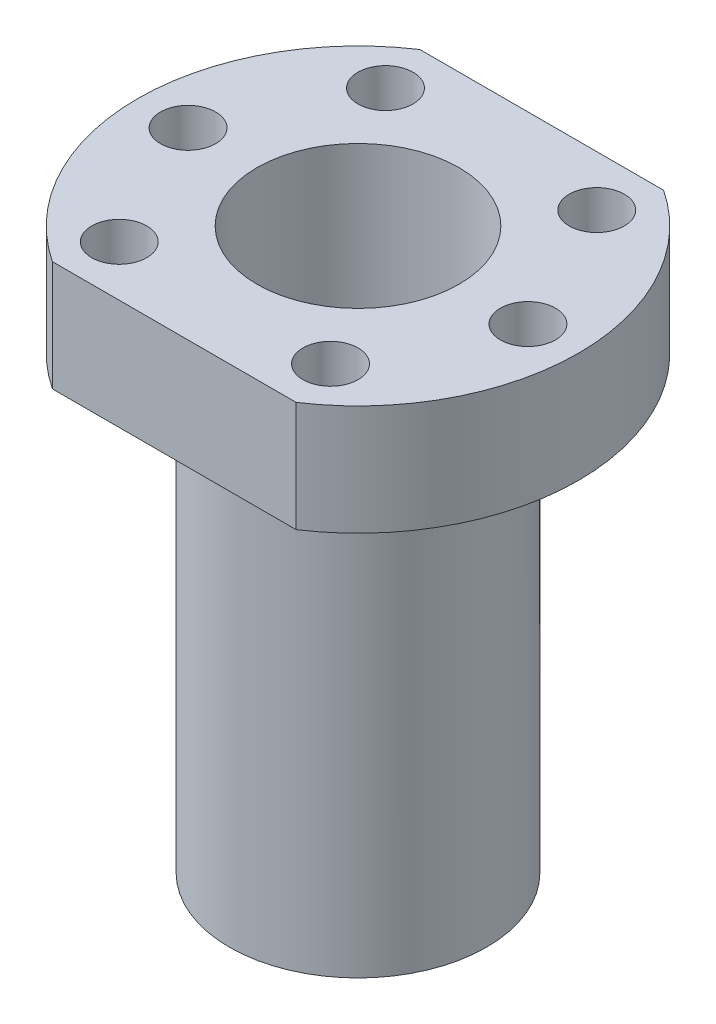
from build123d import *

# Parameters (mm, degrees)
BOSS_EXTRUDE1_DEPTH = 12
SKETCH2_R           = 14
BOSS_EXTRUDE2_DEPTH = 49
SKETCH3_R           = 11
SKETCH3_R_2         = 3
CUT_EXTRUDE1_DEPTH  = 69.534662763


with BuildPart() as part:
    # Sketch1 → Boss-Extrude1 (new body)
    with BuildSketch(Plane(origin=(0, 0, 0), x_dir=(1, 0, 0), z_dir=(0, 1, 0))):
        with BuildLine():
            Line((0, 20), (13.266499161, 20))
            ThreePointArc((13.266499161, 20), (24, 0), (13.266499161, -20))
            Line((13.266499161, -20), (-13.266499161, -20))
            ThreePointArc((-13.266499161, -20), (-24, 0), (-13.266499161, 20))
            Line((-13.266499161, 20), (0, 20))
        make_face()
    extrude(amount=BOSS_EXTRUDE1_DEPTH)

    # Sketch2 → Boss-Extrude2 (add)
    with BuildSketch(Plane.XZ):
        with Locations(Location((0, 0, 0), (0, 0, 90))):
            Circle(SKETCH2_R)
    extrude(amount=BOSS_EXTRUDE2_DEPTH)

    # Sketch3 → Cut-Extrude1 (cut, through all)
    with BuildSketch(Plane(origin=(0, 12, 0), x_dir=(1, 0, 0), z_dir=(0, 1, 0))):
        with Locations(Location((0, 0, 0), (0, 0, 270))):
            Circle(SKETCH3_R)
        with Locations(Location((-11.5, 14.491376746, 0), (0, 0, 270))):
            Circle(SKETCH3_R_2)
        with Locations(Location((-18.5, 0, 0), (0, 0, 270))):
            Circle(SKETCH3_R_2)
        with Locations(Location((-11.5, -14.491376746, 0), (0, 0, 270))):
            Circle(SKETCH3_R_2)
        with Locations(Location((11.5, -14.491376746, 0), (0, 0, 270))):
            Circle(SKETCH3_R_2)
        with Locations(Location((18.5, 0, 0), (0, 0, 270))):
            Circle(SKETCH3_R_2)
        with Locations(Location((11.5, 14.491376746, 0), (0, 0, 270))):
            Circle(SKETCH3_R_2)
    extrude(amount=-CUT_EXTRUDE1_DEPTH, mode=Mode.SUBTRACT)


solid = part.part
